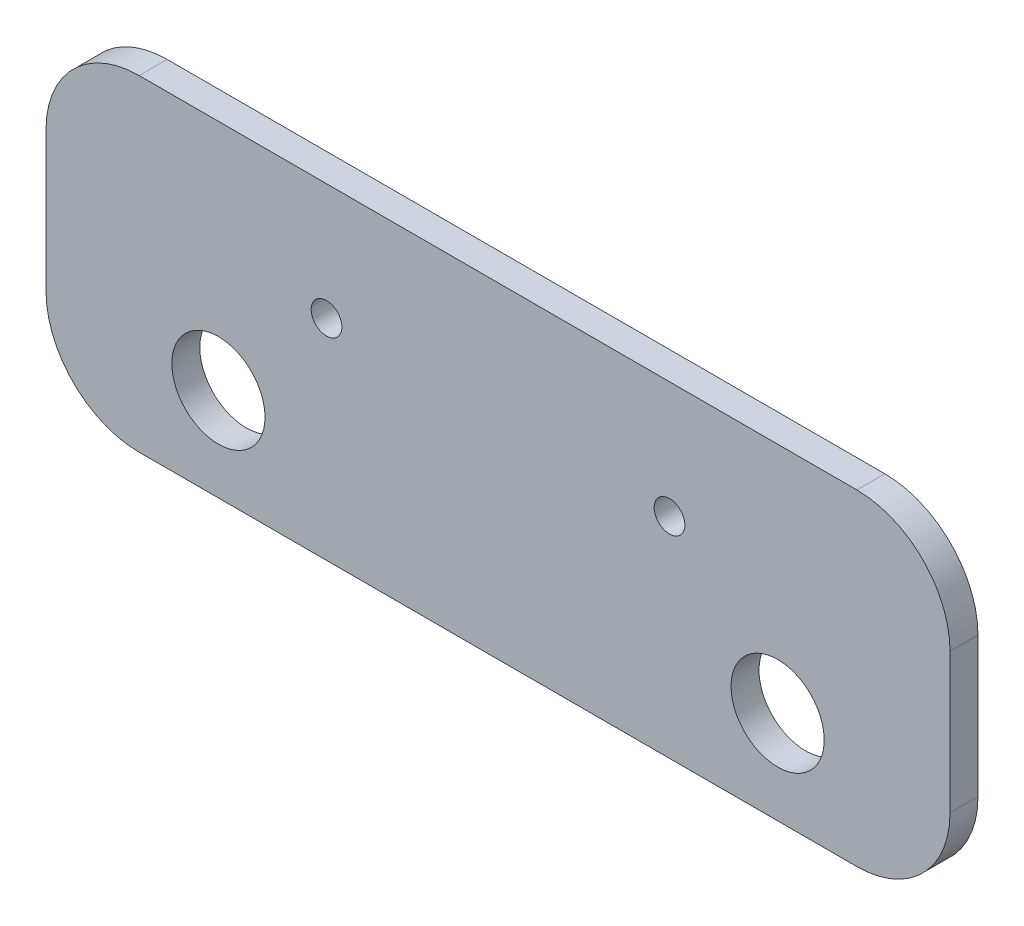
from build123d import *

# Parameters (mm, degrees)
SKETCH_1_W          = 91
SKETCH_1_H          = 35
EXTRUDE_2_DEPTH     = 3
SKETCH_2_R          = 1.25
CUT_EXTRUDE_1_DEPTH = 3
SKETCH_3_W          = 91
SKETCH_3_H          = 3
EXTRUDE_3_DEPTH     = 12
EXTRUDE_4_DEPTH     = 3
SKETCH_6_R          = 1.25
CUT_EXTRUDE_2_DEPTH = 3
SKETCH_7_W          = 27
SKETCH_7_H          = 35
EXTRUDE_5_DEPTH     = 3
SKETCH_8_R          = 1.25
CUT_EXTRUDE_3_DEPTH = 3
CUT_EXTRUDE_4_DEPTH = 57.669628421
SKETCH_10_R         = 5
CUT_EXTRUDE_5_DEPTH = 57.669628421
FILLET_1_R          = 10
SKETCH_11_R         = 1.65
CUT_EXTRUDE_6_DEPTH = 10
EXTRUDE_START       = -3
SKETCH_12_R         = 1.25
EXTRUDE_6_DEPTH     = 3


with BuildPart() as part:
    # 草图1 → 凸台-拉伸2 (new body)
    with BuildSketch(Plane.XY):
        Rectangle(SKETCH_1_W, SKETCH_1_H)
    extrude(amount=EXTRUDE_2_DEPTH)

    # 草图2 → 切除-拉伸1 (cut)
    with BuildSketch(Plane(origin=(0, 0, 0), x_dir=(-1, 0, 0), z_dir=(0, 0, -1))):
        with Locations((-22.5, 5)):
            Circle(SKETCH_2_R)
        with Locations(Location((22.5, 5, 0), (0, 0, 180))):
            Circle(SKETCH_2_R)
    extrude(amount=-CUT_EXTRUDE_1_DEPTH, mode=Mode.SUBTRACT)

    # 草图3 → 凸台-拉伸3 (add)
    with BuildSketch(Plane(origin=(0, 0, 0), x_dir=(-1, 0, 0), z_dir=(0, 0, -1))):
        with Locations((0, 16)):
            Rectangle(SKETCH_3_W, SKETCH_3_H)
    extrude(amount=EXTRUDE_3_DEPTH)

    # 草图4 → 凸台-拉伸4 (add)
    with BuildSketch(Plane(origin=(45.5, 0, 0), x_dir=(0, 0, -1), z_dir=(1, 0, 0))):
        Polygon((12, 17.5), (24, 17.5), (24, -17.5), (-3, -17.5), (-3, 17.5), align=None)
    extrude(amount=EXTRUDE_4_DEPTH)

    # 草图6 → 切除-拉伸2 (cut)
    with BuildSketch(Plane.ZY.offset(-45.5)):
        with Locations((-20, 9.5)):
            Circle(SKETCH_6_R)
        with Locations(Location((-20, -15.5, 0), (0, 0, 180))):
            Circle(SKETCH_6_R)
    extrude(amount=-CUT_EXTRUDE_2_DEPTH, mode=Mode.SUBTRACT)

    # 草图7 → 凸台-拉伸5 (add)
    with BuildSketch(Plane.ZY.offset(45.5)):
        with Locations((-10.5, 0)):
            Rectangle(SKETCH_7_W, SKETCH_7_H)
    extrude(amount=EXTRUDE_5_DEPTH)

    # 草图8 → 切除-拉伸3 (cut)
    with BuildSketch(Plane.ZY.offset(48.5)):
        with Locations((-20, 9.5)):
            Circle(SKETCH_8_R)
        with Locations(Location((-20, -15.5, 0), (0, 0, 180))):
            Circle(SKETCH_8_R)
    extrude(amount=-CUT_EXTRUDE_3_DEPTH, mode=Mode.SUBTRACT)

    # 草图9 → 切除-拉伸4 (cut)
    with BuildSketch(Plane(origin=(0, 0, 0), x_dir=(-1, 0, 0), z_dir=(0, 0, -1))):
        Polygon((-104.540404499, 43.487772061), (97.135742415, 67.997211031), (114.089056769, -71.503294087), (-87.587090144, -96.012733056), align=None)
    extrude(amount=CUT_EXTRUDE_4_DEPTH, mode=Mode.SUBTRACT)

    # 草图10 → 切除-拉伸5 (cut)
    with BuildSketch(Plane.XY.offset(3)):
        with Locations((-30, -7.5)):
            Circle(SKETCH_10_R)
        with Locations(Location((30, -7.5, 0), (0, 0, 180))):
            Circle(SKETCH_10_R)
    extrude(amount=-CUT_EXTRUDE_5_DEPTH, mode=Mode.SUBTRACT)

    # 圆角1
    fillet_1_edges = [part.edges().sort_by_distance(p)[0] for p in [
        (48.5, -17.5, 1.5),
        (-48.5, 17.5, 1.5),
        (-48.5, -17.5, 1.5),
        (48.5, 17.5, 1.5),
    ]]
    fillet(fillet_1_edges, radius=FILLET_1_R)

    # 草图11 → 切除-拉伸6 (cut)
    with BuildSketch(Plane.XY.offset(3)):
        with Locations((18.4, 5)):
            Circle(SKETCH_11_R)
        with Locations(Location((-18.4, 5, 0), (0, 0, 180))):
            Circle(SKETCH_11_R)
    extrude(amount=-CUT_EXTRUDE_6_DEPTH, mode=Mode.SUBTRACT)

    # 草图12 → 凸台-拉伸6 (add)
    with BuildSketch(Plane.XY.offset(3).offset(EXTRUDE_START)):
        with Locations((22.5, 5)):
            Circle(SKETCH_12_R)
        with Locations((-22.5, 5)):
            Circle(SKETCH_12_R)
    extrude(amount=EXTRUDE_6_DEPTH)


solid = part.part
